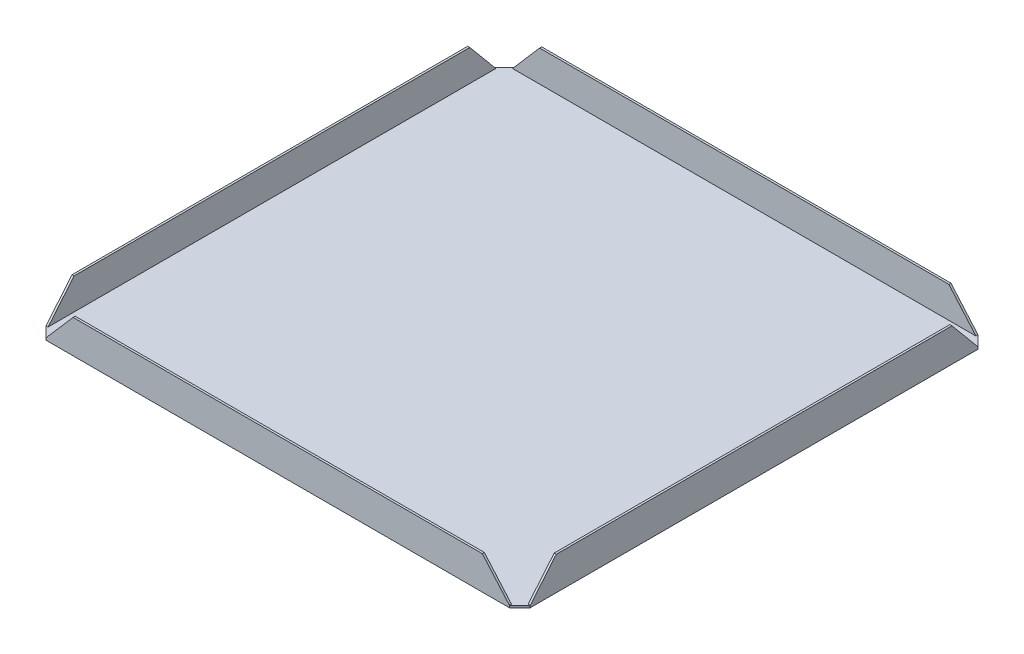
from build123d import *

# Parameters (mm, degrees)
BOSS_EXTRUDE1_DEPTH = 2
BOSS_EXTRUDE2_DEPTH = 2
BOSS_EXTRUDE3_DEPTH = 2


with BuildPart() as part:
    # Sketch1 → Boss-Extrude1 (new body)
    with BuildSketch(Plane(origin=(0, 0, 0), x_dir=(1, 0, 0), z_dir=(0, 1, 0))):
        Polygon((-232.5, 215), (-222.5, 225), (222.5, 225), (232.5, 215), (232.5, -215), (222.5, -225), (-222.5, -225), (-232.5, -215), align=None)
    extrude(amount=BOSS_EXTRUDE1_DEPTH)

    # Sketch3 → Boss-Extrude2 (add)
    with BuildSketch(Plane.XY.offset(225)):
        Polygon((-222.5, 2), (222.5, 2), (196.5, 32), (-196.5, 32), align=None)
    boss_extrude2 = extrude(amount=-BOSS_EXTRUDE2_DEPTH)

    # Sketch4 → Boss-Extrude3 (add)
    with BuildSketch(Plane.ZY.offset(232.5)):
        Polygon((-215, 2), (215, 2), (190, 32), (-190, 32), align=None)
    boss_extrude3 = extrude(amount=-BOSS_EXTRUDE3_DEPTH)

    # Mirror2: Boss-Extrude3 across plane
    add(boss_extrude3.mirror(Plane(origin=(0, 0, 0), x_dir=(0, 0, 1), z_dir=(1, 0, 0))))

    # Mirror3: Boss-Extrude2 across plane
    add(boss_extrude2.mirror(Plane.XY))


solid = part.part
